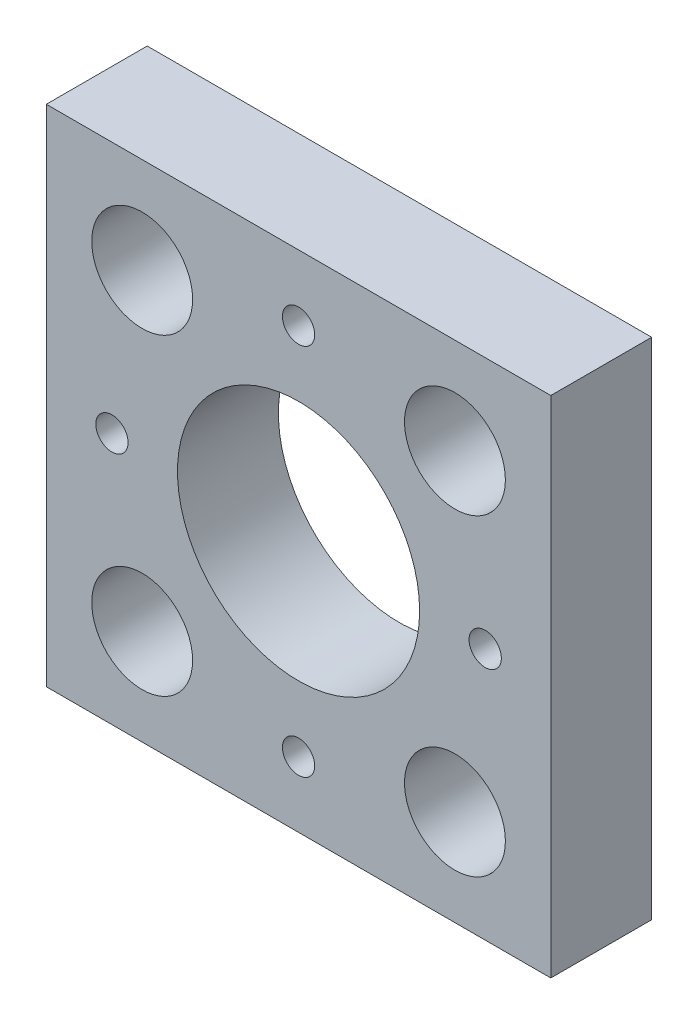
from build123d import *

# Parameters (mm, degrees)
SKETCH_1_W        = 50
SKETCH_1_H        = 50
EXTRUDE_1_DEPTH   = 10
HOLE_WIZARD_339_D = 24
HOLE_WIZARD_2_D   = 3.2
HOLE_WIZARD_3_D   = 10


with BuildPart() as part:
    # 草图1 → 凸台-拉伸1 (new body)
    with BuildSketch(Plane.XY):
        Rectangle(SKETCH_1_W, SKETCH_1_H)
    extrude(amount=EXTRUDE_1_DEPTH)

    # Hole Wizard 339 (through all)
    with Locations(Plane.XY.offset(10)):
        with Locations((0, 0)):
            Hole(HOLE_WIZARD_339_D / 2)

    # 孔2 (through all)
    with Locations(Plane.XY.offset(10)):
        with Locations((0, 18.5), (18.5, 0), (0, -18.5), (-18.5, 0)):
            Hole(HOLE_WIZARD_2_D / 2)

    # 孔3 (through all)
    with Locations(Plane.XY.offset(10)):
        with Locations((-15.5, 15.5), (15.5, 15.5), (15.5, -15.5), (-15.5, -15.5)):
            Hole(HOLE_WIZARD_3_D / 2)


solid = part.part
